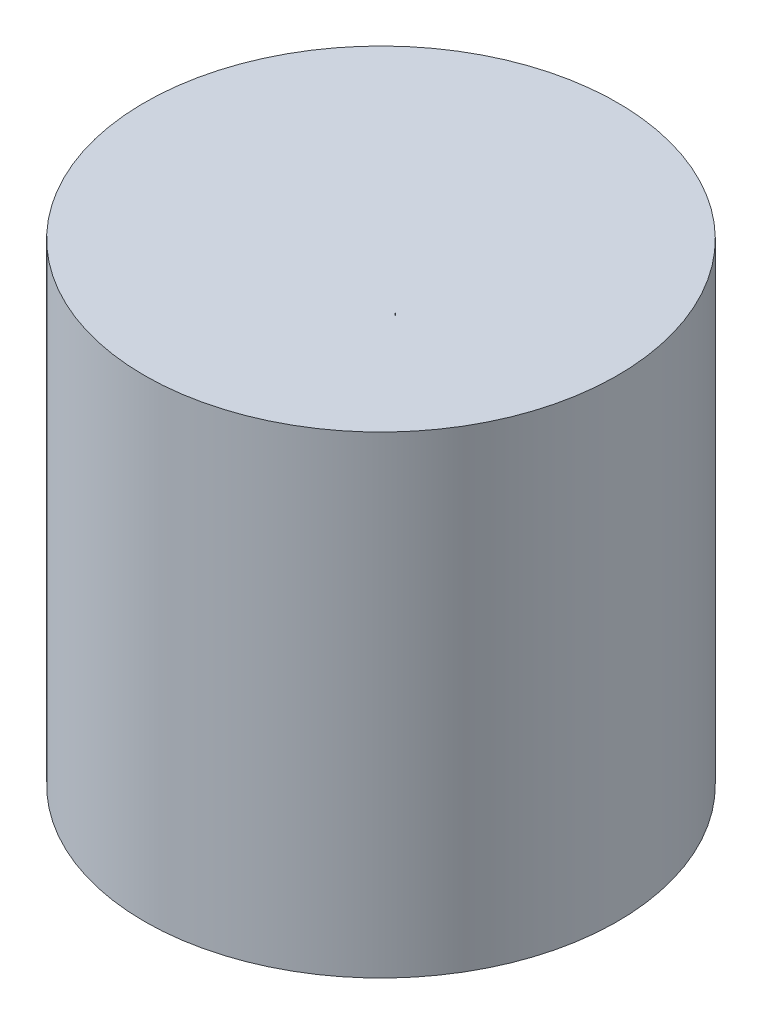
from build123d import *

# Parameters (mm, degrees)
SKETCH2_R            = 6.35
SKETCH2_R_2          = 5.996524519
BOSS_EXTRUDE5_DEPTH  = 12.7
SKETCH2_5_R          = 5.996524519
BOSS_EXTRUDE6_DEPTH  = 2.54
BOSS_EXTRUDE7_DEPTH  = 3.81
BOSS_EXTRUDE8_DEPTH  = 5.08
BOSS_EXTRUDE9_DEPTH  = 6.35
SKETCH2_9_R          = 5.996524519
BOSS_EXTRUDE12_DEPTH = 12.7


with BuildPart() as part:
    # Sketch2 → Boss-Extrude5 (new body)
    with BuildSketch(Plane(origin=(0, 0, 0), x_dir=(1, 0, 0), z_dir=(0, 1, 0))):
        Circle(SKETCH2_R)
        Circle(SKETCH2_R_2, mode=Mode.SUBTRACT)
    extrude(amount=BOSS_EXTRUDE5_DEPTH)

    # Sketch2<5> → Boss-Extrude6 (add)
    with BuildSketch(Plane(origin=(0, 0, 0), x_dir=(1, 0, 0), z_dir=(0, 1, 0))):
        Circle(SKETCH2_5_R)
        with BuildLine():
            ThreePointArc((1.884352254, -1.495029686), (1.927203331, -1.537802313), (1.967424302, -1.583056993))
            add(Edge.make_bspline(
                [(1.884352254, -1.495029686), (1.924927612, -1.545625193), (1.967424302, -1.583056993)],
                knots=[2.708156781, 2.708156781, 2.708156781, 2.825642238, 2.825642238, 2.825642238], degree=2, weights=[1, 0.998275142, 1]))
        make_face(mode=Mode.SUBTRACT)
    extrude(amount=BOSS_EXTRUDE6_DEPTH)

    # Sketch2<6> → Boss-Extrude7 (add)
    with BuildSketch(Plane(origin=(0, 0, 0), x_dir=(1, 0, 0), z_dir=(0, 1, 0))):
        with BuildLine():
            Line((2.203644713, 2.412375149), (2.203644713, -1.684450362))
            add(Edge.make_bspline(
                [(2.203644713, -1.684450362), (2.963880375, -1.684450362), (2.963880375, 0.363962394), (2.963880375, 2.412375149), (2.203644713, 2.412375149)],
                knots=[3.141592654, 3.141592654, 3.141592654, 4.71238898, 4.71238898, 6.283185307, 6.283185307, 6.283185307], degree=2, weights=[1, 0.707106781, 1, 0.707106781, 1]))
        make_face()
    extrude(amount=BOSS_EXTRUDE7_DEPTH)

    # Sketch2<7> → Boss-Extrude8 (add)
    with BuildSketch(Plane(origin=(0, 0, 0), x_dir=(1, 0, 0), z_dir=(0, 1, 0))):
        with BuildLine():
            Line((0.175754582, -0.482779286), (0.175754582, -2.233509451))
            Line((0.175754582, -2.233509451), (0.176349615, -2.233509451))
            ThreePointArc((0.176349615, -2.233509451), (1.189997164, -3.247157), (2.203644713, -2.233509451))
            Line((2.203644713, -2.233509451), (2.203644713, -1.684450362))
            Line((2.203644713, -1.684450362), (2.203644713, 2.412375149))
            Line((2.203644713, 2.412375149), (2.203644713, 2.961434238))
            ThreePointArc((2.203644713, 2.961434238), (0.758944414, 5.025083358), (-1.674487689, 4.373765582))
            add(Edge.make_bspline(
                [(-2.181065395, 3.145924813), (-0.969249834, 3.082016488), (-0.735212375, 3.64927543), (-0.501174917, 4.216534371), (-1.674487689, 4.373765582)],
                knots=[1.460003031, 1.460003031, 1.460003031, 2.948448562, 2.948448562, 4.436894093, 4.436894093, 4.436894093], degree=2, weights=[1, 0.735614623, 1, 0.735614623, 1]))
            ThreePointArc((-2.181065395, 3.145924813), (-2.18688649, 3.053761144), (-2.188828, 2.961434238))
            Line((-2.188828, 2.961434238), (-2.188828, -2.233509451))
            ThreePointArc((-2.188828, -2.233509451), (-1.217415765, -3.204921686), (-0.24600353, -2.233509451))
            Line((-0.24600353, -2.233509451), (-0.24600353, -0.482779286))
            Line((-0.24600353, -0.482779286), (0.175754582, -0.482779286))
        make_face()
        with BuildLine():
            ThreePointArc((1.884352254, -1.495029686), (1.927203331, -1.537802313), (1.967424302, -1.583056993))
            add(Edge.make_bspline(
                [(1.884352254, -1.495029686), (1.924927612, -1.545625193), (1.967424302, -1.583056993)],
                knots=[2.708156781, 2.708156781, 2.708156781, 2.825642238, 2.825642238, 2.825642238], degree=2, weights=[1, 0.998275142, 1]))
        make_face(mode=Mode.SUBTRACT)
    extrude(amount=BOSS_EXTRUDE8_DEPTH)

    # Sketch2<8> → Boss-Extrude9 (add)
    with BuildSketch(Plane(origin=(0, 0, 0), x_dir=(1, 0, 0), z_dir=(0, 1, 0))):
        with BuildLine():
            add(Edge.make_bspline(
                [(-2.181065395, 3.145924813), (-0.969249834, 3.082016488), (-0.735212375, 3.64927543), (-0.501174917, 4.216534371), (-1.674487689, 4.373765582)],
                knots=[1.460003031, 1.460003031, 1.460003031, 2.948448562, 2.948448562, 4.436894093, 4.436894093, 4.436894093], degree=2, weights=[1, 0.735614623, 1, 0.735614623, 1]))
            add(Edge.make_bspline(
                [(-1.674487689, 4.373765582), (-3.358741472, 4.599466068), (-3.358741472, 3.769755627)],
                knots=[4.436894093, 4.436894093, 4.436894093, 6.283185307, 6.283185307, 6.283185307], degree=2, weights=[1, 0.603314513, 1]))
            add(Edge.make_bspline(
                [(-3.358741472, 3.769755627), (-3.358741472, 3.208032701), (-2.181065395, 3.145924813)],
                knots=[0, 0, 0, 1.460003031, 1.460003031, 1.460003031], degree=2, weights=[1, 0.745173392, 1]))
        make_face()
    extrude(amount=BOSS_EXTRUDE9_DEPTH)

    # Sketch2<9> → Boss-Extrude12 (add)
    with BuildSketch(Plane(origin=(0, 0, 0), x_dir=(1, 0, 0), z_dir=(0, 1, 0))):
        Circle(SKETCH2_9_R)
        with BuildLine():
            ThreePointArc((1.884352254, -1.495029686), (1.927203331, -1.537802313), (1.967424302, -1.583056993))
            add(Edge.make_bspline(
                [(1.884352254, -1.495029686), (1.924927612, -1.545625193), (1.967424302, -1.583056993)],
                knots=[2.708156781, 2.708156781, 2.708156781, 2.825642238, 2.825642238, 2.825642238], degree=2, weights=[1, 0.998275142, 1]))
        make_face(mode=Mode.SUBTRACT)
    extrude(amount=BOSS_EXTRUDE12_DEPTH)


solid = part.part
